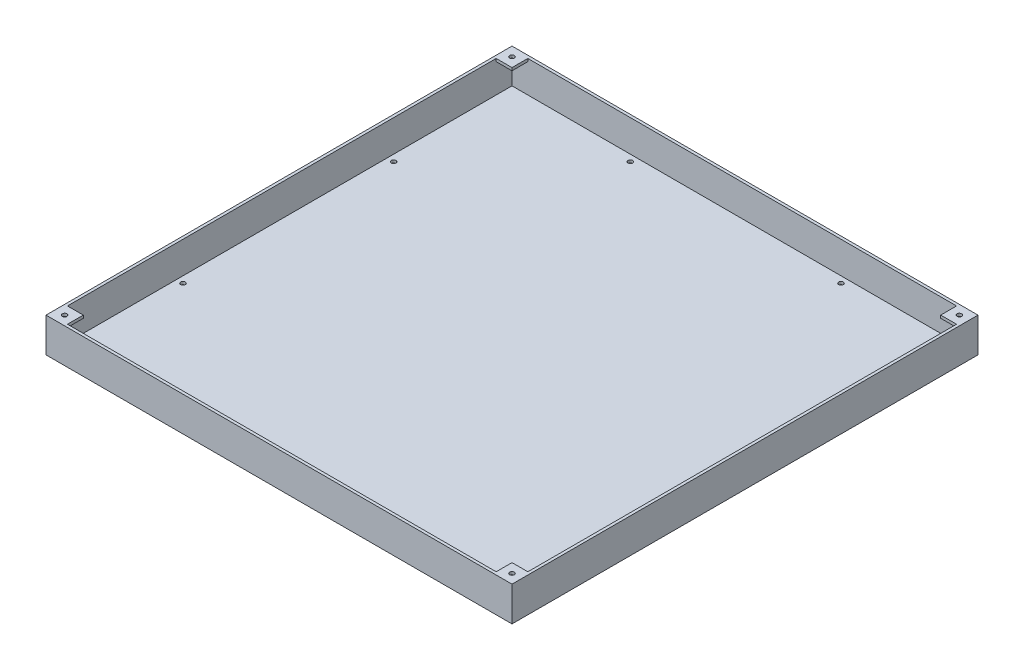
from build123d import *

# Parameters (mm, degrees)
SKETCH1_W           = 500
SKETCH1_H           = 500
BOSS_EXTRUDE1_DEPTH = 37
SHELL1_T            = -3
SKETCH3_R           = 2.5
CUT_EXTRUDE1_DEPTH  = 37
SKETCH4_W           = 17
SKETCH4_H           = 17
BOSS_EXTRUDE2_DEPTH = 3
SKETCH5_R           = 2.5
CUT_EXTRUDE2_DEPTH  = 3


with BuildPart() as part:
    # Sketch1 → Boss-Extrude1 (new body)
    with BuildSketch(Plane(origin=(0, 0, 0), x_dir=(1, 0, 0), z_dir=(0, 1, 0))):
        Rectangle(SKETCH1_W, SKETCH1_H)
    extrude(amount=BOSS_EXTRUDE1_DEPTH)

    # Shell1
    shell1_openings = [part.faces().sort_by_distance(p)[0] for p in [
        (0, 37, 0),
    ]]
    offset(amount=SHELL1_T, openings=shell1_openings, kind=Kind.INTERSECTION)

    # Sketch3 → Cut-Extrude1 (cut)
    with BuildSketch(Plane(origin=(0, 37, 0), x_dir=(1, 0, 0), z_dir=(0, 1, 0))):
        with Locations(Location((113, -240, 0), (0, 0, 270))):
            Circle(SKETCH3_R)
        with Locations(Location((-113, -240, 0), (0, 0, 270))):
            Circle(SKETCH3_R)
        with Locations(Location((240, 113, 0), (0, 0, 270))):
            Circle(SKETCH3_R)
        with Locations(Location((240, -113, 0), (0, 0, 270))):
            Circle(SKETCH3_R)
        with Locations(Location((-240, -113, 0), (0, 0, 270))):
            Circle(SKETCH3_R)
        with Locations(Location((-240, 113, 0), (0, 0, 270))):
            Circle(SKETCH3_R)
        with Locations(Location((-113, 240, 0), (0, 0, 270))):
            Circle(SKETCH3_R)
        with Locations(Location((113, 240, 0), (0, 0, 270))):
            Circle(SKETCH3_R)
    extrude(amount=-CUT_EXTRUDE1_DEPTH, mode=Mode.SUBTRACT)

    # Sketch4 → Boss-Extrude2 (add)
    with BuildSketch(Plane(origin=(0, 37, 0), x_dir=(1, 0, 0), z_dir=(0, 1, 0))):
        with Locations((-238.5, 238.5)):
            Rectangle(SKETCH4_W, SKETCH4_H)
        with Locations((238.5, 238.5)):
            Rectangle(SKETCH4_W, SKETCH4_H)
        with Locations((238.5, -238.5)):
            Rectangle(SKETCH4_W, SKETCH4_H)
        with Locations((-238.5, -238.5)):
            Rectangle(SKETCH4_W, SKETCH4_H)
    extrude(amount=-BOSS_EXTRUDE2_DEPTH)

    # Sketch5 → Cut-Extrude2 (cut)
    with BuildSketch(Plane(origin=(0, 37, 0), x_dir=(1, 0, 0), z_dir=(0, 1, 0))):
        with Locations(Location((-240, 240, 0), (0, 0, 270))):
            Circle(SKETCH5_R)
        with Locations(Location((240, 240, 0), (0, 0, 90))):
            Circle(SKETCH5_R)
        with Locations(Location((240, -240, 0), (0, 0, 270))):
            Circle(SKETCH5_R)
        with Locations(Location((-240, -240, 0), (0, 0, 90))):
            Circle(SKETCH5_R)
    extrude(amount=-CUT_EXTRUDE2_DEPTH, mode=Mode.SUBTRACT)


solid = part.part
